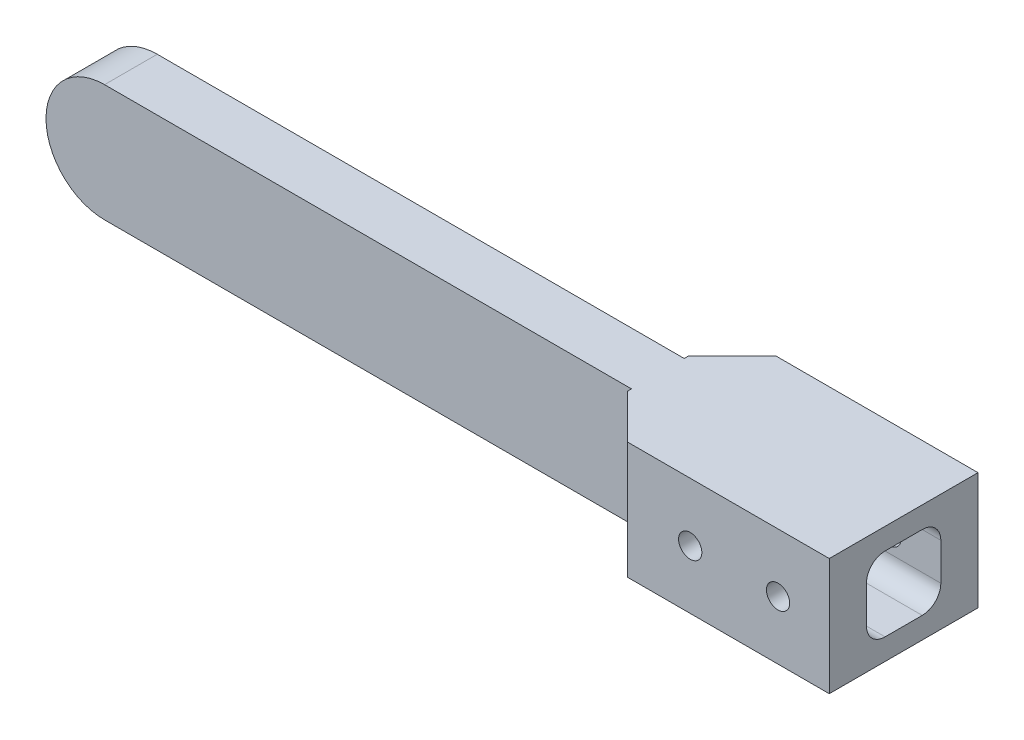
from build123d import *

# Parameters (mm, degrees)
SALIENTE_EXTRUIR1_DEPTH = 40
REDONDEO1_RADIUS        = 20
REDONDEO1_LENGTH        = 18
CROQUIS3_W              = 25.4
CROQUIS3_H              = 25.4
CORTAR_EXTRUIR2_DEPTH   = 65
CROQUIS4_R              = 3.96875
CORTAR_EXTRUIR3_DEPTH   = 292.21181988
REDONDEO3_R             = 6.35


with BuildPart() as part:
    # Croquis1 → Saliente-Extruir1 (new body)
    with BuildSketch(Plane(origin=(0, 0, 0), x_dir=(1, 0, 0), z_dir=(0, 1, 0))):
        Polygon((283.9431, 16.4), (283.9431, -34.4), (215, -34.4), (200, -19.4), (200, -18), (0, -18), (0, 0), (200, 0), (200, 1.4), (215, 16.4), align=None)
    extrude(amount=SALIENTE_EXTRUIR1_DEPTH)

    # Redondeo1: full round fillet: the end face becomes a half cylinder, R = half its width
    redondeo1_face = Plane((0, 20, 9), x_dir=(0, 0, 1), z_dir=(-1, 0, 0))  # on the end face: x along it, z out of the body
    redondeo1_slab = redondeo1_face.offset(-REDONDEO1_RADIUS / 2) * Box(REDONDEO1_LENGTH, 2 * REDONDEO1_RADIUS, REDONDEO1_RADIUS, mode=Mode.PRIVATE)  # the body's end, R deep
    redondeo1_round = Plane((20, 20, 9), x_dir=(-1, 0, 0), z_dir=(0, 0, 1)) * Cylinder(REDONDEO1_RADIUS, REDONDEO1_LENGTH, mode=Mode.PRIVATE)  # its axis R under the face
    add(redondeo1_slab - redondeo1_round, mode=Mode.SUBTRACT)

    # Croquis3 → Cortar-Extruir2 (cut)
    with BuildSketch(Plane(origin=(283.9431, 0, 0), x_dir=(0, 0, -1), z_dir=(1, 0, 0))):
        with Locations((-9, 20)):
            Rectangle(CROQUIS3_W, CROQUIS3_H)
    extrude(amount=-CORTAR_EXTRUIR2_DEPTH, mode=Mode.SUBTRACT)

    # Croquis4 → Cortar-Extruir3 (cut, through all)
    with BuildSketch(Plane.XY.offset(34.4)):
        with Locations((266.4431, 20)):
            Circle(CROQUIS4_R)
        with Locations((236.4431, 20)):
            Circle(CROQUIS4_R)
    extrude(amount=-CORTAR_EXTRUIR3_DEPTH, mode=Mode.SUBTRACT)

    # Redondeo3
    redondeo3_edges = [part.edges().sort_by_distance(p)[0] for p in [
        (251.4431, 7.3, 21.7),
        (251.4431, 32.7, 21.7),
        (251.4431, 32.7, -3.7),
        (251.4431, 7.3, -3.7),
    ]]
    fillet(redondeo3_edges, radius=REDONDEO3_R)


solid = part.part
